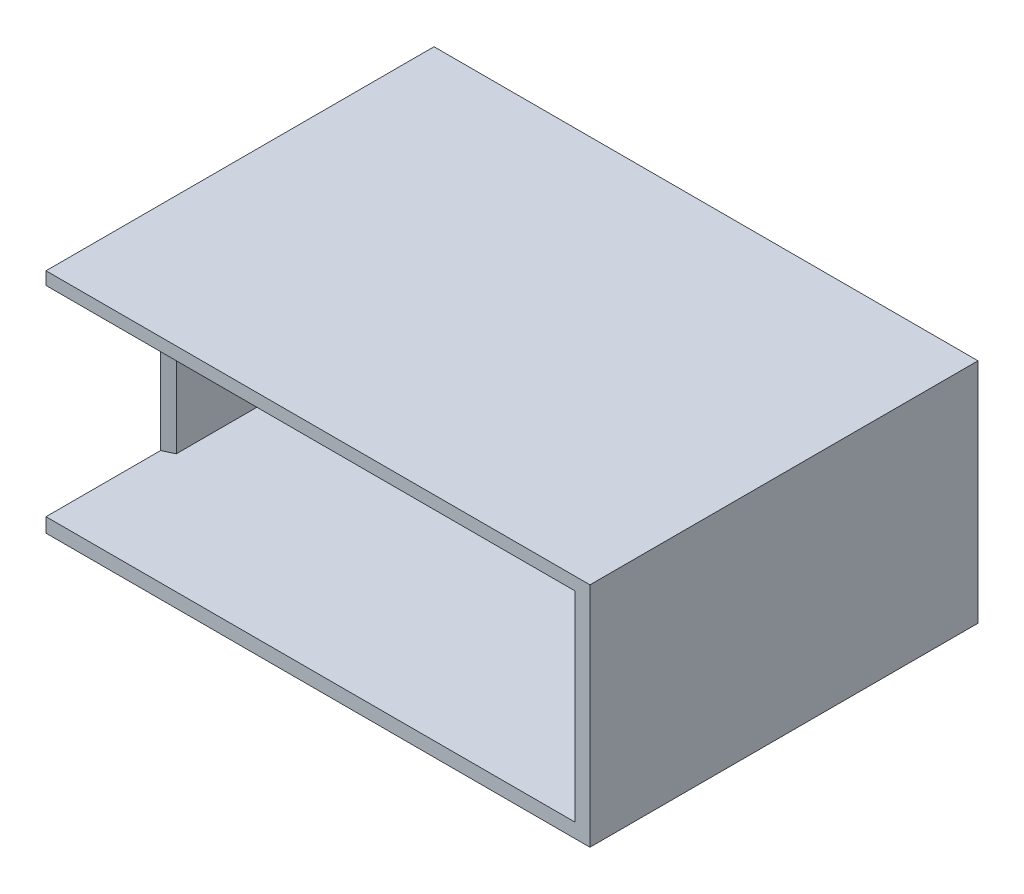
from build123d import *

# Parameters (mm, degrees)
BOSS_EXTRUDE1_DEPTH = 25
SKETCH16_W          = 33.4
SKETCH16_H          = 12.9
CUT_EXTRUDE10_DEPTH = 4.5
SKETCH19_R          = 20
CUT_EXTRUDE14_DEPTH = 7.55
SKETCH17_W          = 23.6
SKETCH17_H          = 12.9
CUT_EXTRUDE11_DEPTH = 177.45821035
CUT_EXTRUDE13_DEPTH = 6.45
SKETCH20_W          = 33.4
SKETCH20_H          = 12.9
CUT_EXTRUDE15_DEPTH = 176.655202029
SKETCH21_R          = 1.1
CUT_EXTRUDE16_DEPTH = 177.45821035
SKETCH22_R          = 2
CUT_EXTRUDE17_DEPTH = 17.45
SKETCH23_W          = 162.562335495
SKETCH23_H          = 86.576971135
CUT_EXTRUDE18_DEPTH = 177.45821035
CUT_EXTRUDE19_DEPTH = 177.45821035
SKETCH26_W          = 6.440152625
SKETCH26_H          = 21.054345118
CUT_EXTRUDE20_DEPTH = 175.458005773


with BuildPart() as part:
    # Sketch1 → Boss-Extrude1 (new body)
    with BuildSketch(Plane.XY):
        with BuildLine():
            ThreePointArc((172.5, 0), (152.823244805, 26.363741023), (121.951138857, 15))
            Line((121.951138857, 15), (145, 15))
            Line((145, 15), (145, -15))
            Line((145, -15), (121.951138857, -15))
            ThreePointArc((121.951138857, -15), (152.823244805, -26.363741023), (172.5, 0))
        make_face()
        with BuildLine():
            Line((145, 15), (121.951138857, 15))
            ThreePointArc((121.951138857, 15), (117.5, 0), (121.951138857, -15))
            Line((121.951138857, -15), (145, -15))
            Line((145, -15), (145, 15))
        make_face()
        with BuildLine():
            Line((121.951138857, 15), (23.048861143, 15))
            ThreePointArc((23.048861143, 15), (26.363741023, 7.823244805), (27.5, 0))
            ThreePointArc((27.5, 0), (26.363741023, -7.823244805), (23.048861143, -15))
            Line((23.048861143, -15), (121.951138857, -15))
            ThreePointArc((121.951138857, -15), (117.5, 0), (121.951138857, 15))
        make_face()
        with BuildLine():
            ThreePointArc((13.228756555, -15), (-20, 0), (13.228756555, 15))
            Line((13.228756555, 15), (23.048861143, 15))
            ThreePointArc((23.048861143, 15), (-27.5, 0), (23.048861143, -15))
            Line((23.048861143, -15), (13.228756555, -15))
        make_face()
        with BuildLine():
            Line((23.048861143, 15), (13.228756555, 15))
            ThreePointArc((13.228756555, 15), (18.228756555, 8.228756555), (20, 0))
            ThreePointArc((20, 0), (18.228756555, -8.228756555), (13.228756555, -15))
            Line((13.228756555, -15), (23.048861143, -15))
            ThreePointArc((23.048861143, -15), (26.363741023, -7.823244805), (27.5, 0))
            ThreePointArc((27.5, 0), (26.363741023, 7.823244805), (23.048861143, 15))
        make_face()
        with BuildLine():
            Line((0, -15), (0, 15))
            Line((0, 15), (13.228756555, 15))
            ThreePointArc((13.228756555, 15), (-20, 0), (13.228756555, -15))
            Line((13.228756555, -15), (0, -15))
        make_face()
        with BuildLine():
            Line((13.228756555, 15), (0, 15))
            Line((0, 15), (0, -15))
            Line((0, -15), (13.228756555, -15))
            ThreePointArc((13.228756555, -15), (18.228756555, -8.228756555), (20, 0))
            ThreePointArc((20, 0), (18.228756555, 8.228756555), (13.228756555, 15))
        make_face()
    extrude(amount=BOSS_EXTRUDE1_DEPTH)

    # Sketch16 → Cut-Extrude10 (cut)
    with BuildSketch(Plane(origin=(0, 0, 0), x_dir=(-1, 0, 0), z_dir=(0, 0, -1))):
        with Locations((-150.21934279, 0)):
            Rectangle(SKETCH16_W, SKETCH16_H)
    extrude(amount=-CUT_EXTRUDE10_DEPTH, mode=Mode.SUBTRACT)

    # Sketch19 → Cut-Extrude14 (cut)
    with BuildSketch(Plane(origin=(0, 0, 0), x_dir=(-1, 0, 0), z_dir=(0, 0, -1))):
        Circle(SKETCH19_R)
    extrude(amount=-CUT_EXTRUDE14_DEPTH, mode=Mode.SUBTRACT)

    # Sketch17 → Cut-Extrude11 (cut, through all)
    with BuildSketch(Plane(origin=(0, 0, 0), x_dir=(-1, 0, 0), z_dir=(0, 0, -1))):
        with Locations((-150.21934279, 0)):
            Rectangle(SKETCH17_W, SKETCH17_H)
    extrude(amount=-CUT_EXTRUDE11_DEPTH, mode=Mode.SUBTRACT)

    # Sketch18 → Cut-Extrude13 (cut, symmetric)
    with BuildSketch(Plane(origin=(0, 0, 0), x_dir=(-1, 0, 0), z_dir=(0, -1, 0))):
        Polygon((-138.41934279, -15), (-138.41934279, -25), (-122.41934279, -25), (-122.41934279, -22.5), align=None)
    extrude(amount=CUT_EXTRUDE13_DEPTH, both=True, mode=Mode.SUBTRACT)

    # Sketch20 → Cut-Extrude15 (cut, through all)
    with BuildSketch(Plane(origin=(0, 0, 6.5), x_dir=(-1, 0, 0), z_dir=(0, 0, -1))):
        with Locations((-150.21934279, 0)):
            Rectangle(SKETCH20_W, SKETCH20_H)
    extrude(amount=-CUT_EXTRUDE15_DEPTH, mode=Mode.SUBTRACT)

    # Sketch21 → Cut-Extrude16 (cut, through all)
    with BuildSketch(Plane(origin=(0, 0, 0), x_dir=(-1, 0, 0), z_dir=(0, 0, -1))):
        with Locations((-163.75, 0)):
            Circle(SKETCH21_R)
        with Locations((-136.75, 0)):
            Circle(SKETCH21_R)
    extrude(amount=-CUT_EXTRUDE16_DEPTH, mode=Mode.SUBTRACT)

    # Sketch22 → Cut-Extrude17 (cut)
    with BuildSketch(Plane.XY.offset(25)):
        Circle(SKETCH22_R)
    extrude(amount=-CUT_EXTRUDE17_DEPTH, mode=Mode.SUBTRACT)

    # Sketch23 → Cut-Extrude18 (cut, through all)
    with BuildSketch(Plane(origin=(0, 0, 0), x_dir=(-1, 0, 0), z_dir=(0, 0, -1))):
        with Locations((-51.54910521, 1.570557299)):
            Rectangle(SKETCH23_W, SKETCH23_H)
    extrude(amount=-CUT_EXTRUDE18_DEPTH, mode=Mode.SUBTRACT)

    # Sketch24 → Cut-Extrude19 (cut, through all)
    with BuildSketch(Plane(origin=(0, 0, 0), x_dir=(-1, 0, 0), z_dir=(0, 0, -1))):
        with BuildLine():
            Line((-167.786941529, -7.371958929), (-171.493475075, -7.371958929))
            ThreePointArc((-171.493475075, -7.371958929), (-156.225736685, -25.104438569), (-132.830272958, -24.66065173))
            Line((-132.830272958, -24.66065173), (-132.830272958, -7.371958929))
            Line((-132.830272958, -7.371958929), (-167.786941529, -7.371958929))
        make_face()
        with BuildLine():
            Line((-185.462542345, -7.371958929), (-172.088300957, -7.371958929))
            Line((-172.088300957, -7.371958929), (-171.493475075, -7.371958929))
            ThreePointArc((-171.493475075, -7.371958929), (-172.499951334, -0.051736146), (-171.521025432, 7.272221809))
            Line((-171.521025432, 7.272221809), (-172.314497195, 7.272221809))
            Line((-172.314497195, 7.272221809), (-185.462542345, 7.272221809))
            Line((-185.462542345, 7.272221809), (-185.462542345, -7.371958929))
        make_face()
        with BuildLine():
            ThreePointArc((-132.830272958, 24.66065173), (-156.272946161, 25.083275003), (-171.521025432, 7.272221809))
            Line((-171.521025432, 7.272221809), (-167.786941529, 7.272221809))
            Line((-167.786941529, 7.272221809), (-132.830272958, 7.272221809))
            Line((-132.830272958, 7.272221809), (-132.830272958, 24.66065173))
        make_face()
    extrude(amount=-CUT_EXTRUDE19_DEPTH, mode=Mode.SUBTRACT)

    # Sketch26 → Cut-Extrude20 (cut, through all)
    with BuildSketch(Plane(origin=(0, 0, 0), x_dir=(-1, 0, 0), z_dir=(0, 0, -1))):
        with Locations((-171.097089858, -0.597985902)):
            Rectangle(SKETCH26_W, SKETCH26_H)
    extrude(amount=-CUT_EXTRUDE20_DEPTH, mode=Mode.SUBTRACT)


solid = part.part
